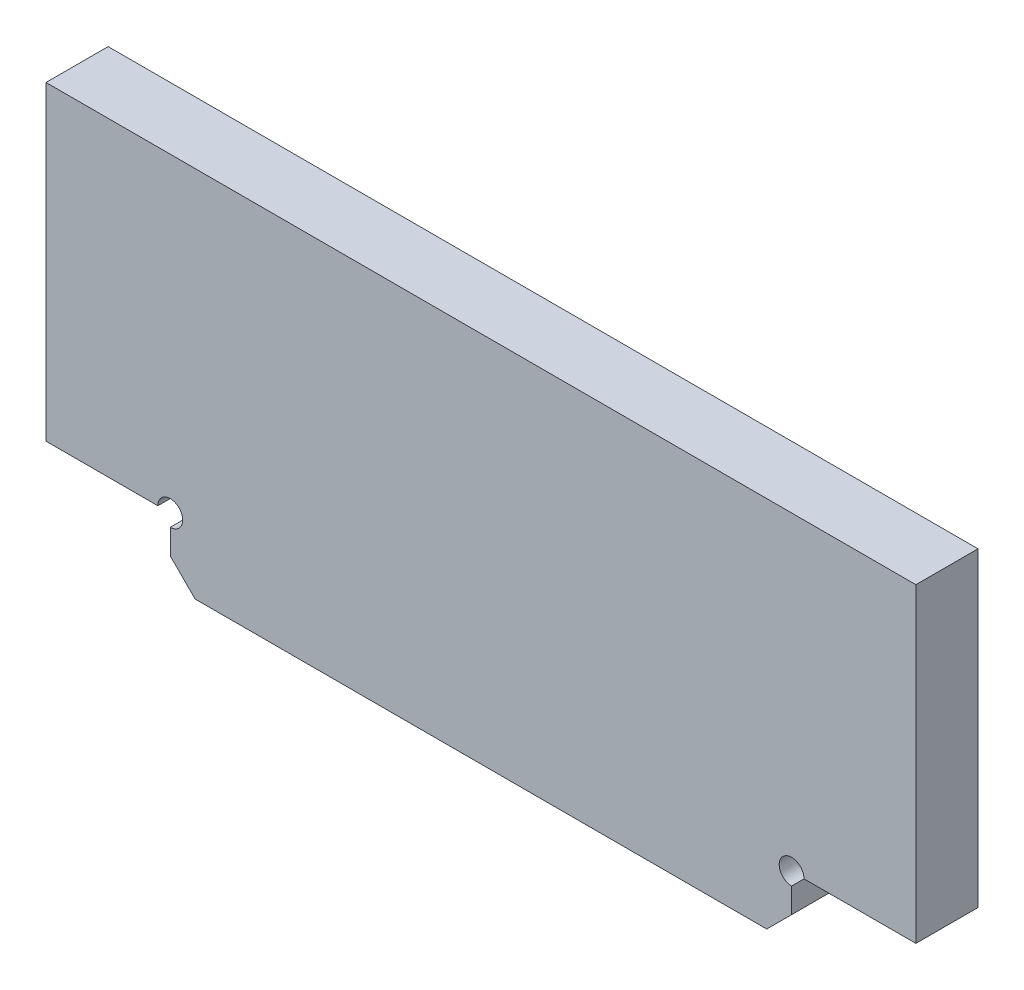
from build123d import *

# Parameters (mm, degrees)
EXTRUDE_1_DEPTH = 2.5


with BuildPart() as part:
    # 草圖1 → 填料-伸長1 (new, symmetric)
    with BuildSketch(Plane.XY):
        with BuildLine():
            Line((-25, 2), (-23, 0))
            Line((-23, 0), (23, 0))
            Line((23, 0), (25, 2))
            Line((25, 2), (25, 4))
            ThreePointArc((25, 4), (24.292893219, 5.707106781), (26, 5))
            Line((26, 5), (35, 5))
            Line((35, 5), (35, 30))
            Line((35, 30), (-35, 30))
            Line((-35, 30), (-35, 5))
            Line((-35, 5), (-26, 5))
            ThreePointArc((-26, 5), (-24.292893219, 5.707106781), (-25, 4))
            Line((-25, 4), (-25, 2))
        make_face()
    extrude(amount=EXTRUDE_1_DEPTH, both=True)


solid = part.part
